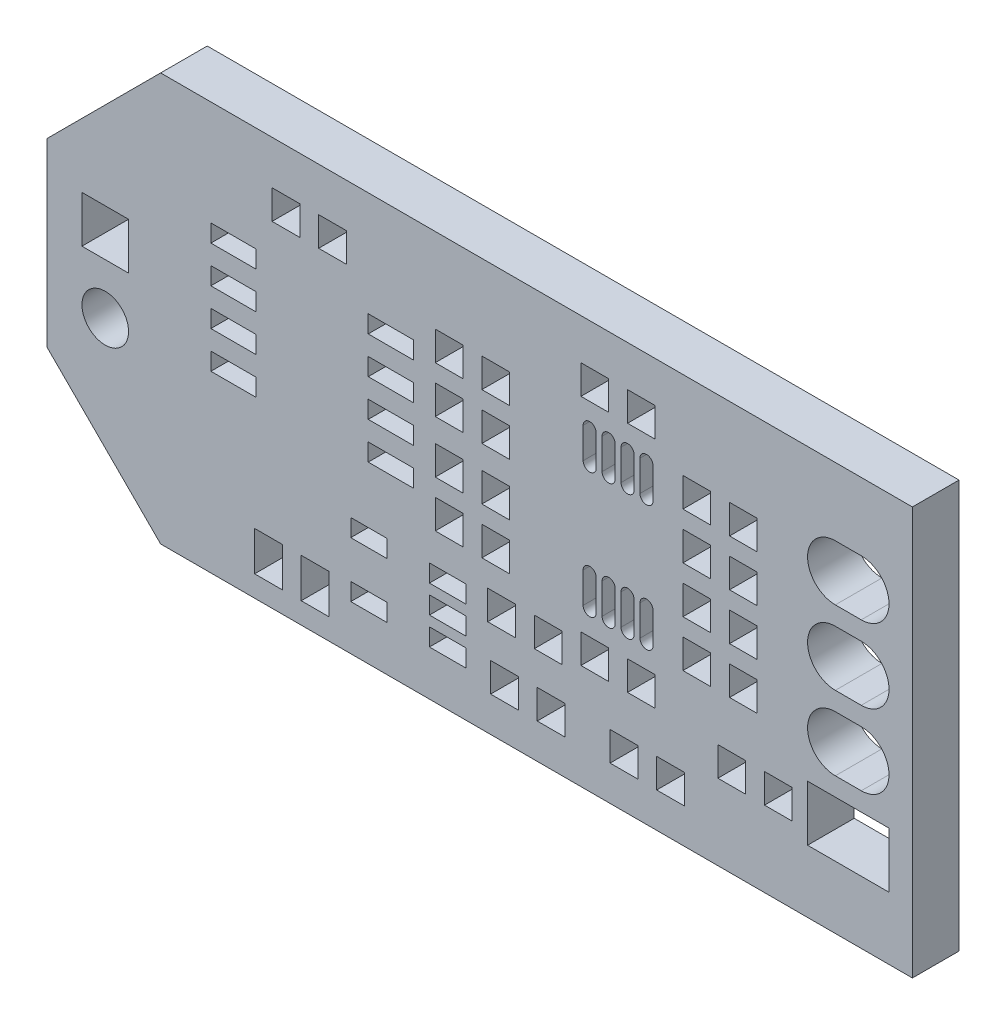
from build123d import *

# Parameters (mm, degrees)
MODEL_R             = 0.8
MODEL_W             = 1.2499
MODEL_H             = 0.5999
MODEL_W_2           = 2.794
MODEL_H_2           = 1.905
MODEL_W_3           = 1.6
MODEL_H_3           = 1.6
MODEL_W_4           = 0.95
MODEL_H_4           = 1.35
MODEL_H_5           = 1
MODEL_W_5           = 1.55
MODEL_H_6           = 0.6
BOSS_EXTRUDE1_DEPTH = 1.6


with BuildPart() as part:
    # Model → Boss-Extrude1 (new body)
    with BuildSketch(Plane.XY):
        Polygon((-146, 24.3), (-120.2, 24.3), (-120.2, 38.3), (-146, 38.3), (-149.9, 34.4), (-149.9, 28.2), align=None)
        with Locations((-147.9, 30.06)):
            Circle(MODEL_R, mode=Mode.SUBTRACT)
        with Locations((-136.15, 26.15)):
            Rectangle(MODEL_W, MODEL_H, mode=Mode.SUBTRACT)
        with Locations((-136.15, 27.1)):
            Rectangle(MODEL_W, MODEL_H, mode=Mode.SUBTRACT)
        with Locations((-136.15, 28.05)):
            Rectangle(MODEL_W, MODEL_H, mode=Mode.SUBTRACT)
        with Locations((-138.85, 28.05)):
            Rectangle(MODEL_W, MODEL_H, mode=Mode.SUBTRACT)
        with Locations((-138.85, 26.15)):
            Rectangle(MODEL_W, MODEL_H, mode=Mode.SUBTRACT)
        with Locations((-122.4, 27.4)):
            Rectangle(MODEL_W_2, MODEL_H_2, mode=Mode.SUBTRACT)
        with BuildLine():
            Line((-122.8445, 30.8925), (-121.9555, 30.8925))
            ThreePointArc((-121.9555, 30.8925), (-121.003, 29.94), (-121.9555, 28.9875))
            Line((-121.9555, 28.9875), (-122.8445, 28.9875))
            ThreePointArc((-122.8445, 28.9875), (-123.797, 29.94), (-122.8445, 30.8925))
        make_face(mode=Mode.SUBTRACT)
        with BuildLine():
            Line((-122.8445, 33.4325), (-121.9555, 33.4325))
            ThreePointArc((-121.9555, 33.4325), (-121.003, 32.48), (-121.9555, 31.5275))
            Line((-121.9555, 31.5275), (-122.8445, 31.5275))
            ThreePointArc((-122.8445, 31.5275), (-123.797, 32.48), (-122.8445, 33.4325))
        make_face(mode=Mode.SUBTRACT)
        with BuildLine():
            Line((-122.8445, 35.9725), (-121.9555, 35.9725))
            ThreePointArc((-121.9555, 35.9725), (-121.003, 35.02), (-121.9555, 34.0675))
            Line((-121.9555, 34.0675), (-122.8445, 34.0675))
            ThreePointArc((-122.8445, 34.0675), (-123.797, 35.02), (-122.8445, 35.9725))
        make_face(mode=Mode.SUBTRACT)
        with Locations((-147.9, 32.6)):
            Rectangle(MODEL_W_3, MODEL_H_3, mode=Mode.SUBTRACT)
        with Locations((-142.3, 25.7)):
            Rectangle(MODEL_W_4, MODEL_H_4, mode=Mode.SUBTRACT)
        with Locations((-140.7, 25.7)):
            Rectangle(MODEL_W_4, MODEL_H_4, mode=Mode.SUBTRACT)
        with BuildLine():
            Line((-131.05, 30.775), (-131.05, 29.725))
            ThreePointArc((-131.05, 29.725), (-131.275, 29.5), (-131.5, 29.725))
            Line((-131.5, 29.725), (-131.5, 30.775))
            ThreePointArc((-131.5, 30.775), (-131.275, 31), (-131.05, 30.775))
        make_face(mode=Mode.SUBTRACT)
        with BuildLine():
            Line((-130.4, 30.775), (-130.4, 29.725))
            ThreePointArc((-130.4, 29.725), (-130.625, 29.5), (-130.85, 29.725))
            Line((-130.85, 29.725), (-130.85, 30.775))
            ThreePointArc((-130.85, 30.775), (-130.625, 31), (-130.4, 30.775))
        make_face(mode=Mode.SUBTRACT)
        with BuildLine():
            Line((-129.75, 30.775), (-129.75, 29.725))
            ThreePointArc((-129.75, 29.725), (-129.975, 29.5), (-130.2, 29.725))
            Line((-130.2, 29.725), (-130.2, 30.775))
            ThreePointArc((-130.2, 30.775), (-129.975, 31), (-129.75, 30.775))
        make_face(mode=Mode.SUBTRACT)
        with BuildLine():
            Line((-129.1, 30.775), (-129.1, 29.725))
            ThreePointArc((-129.1, 29.725), (-129.325, 29.5), (-129.55, 29.725))
            Line((-129.55, 29.725), (-129.55, 30.775))
            ThreePointArc((-129.55, 30.775), (-129.325, 31), (-129.1, 30.775))
        make_face(mode=Mode.SUBTRACT)
        with BuildLine():
            Line((-129.1, 35.075), (-129.1, 34.025))
            ThreePointArc((-129.1, 34.025), (-129.325, 33.8), (-129.55, 34.025))
            Line((-129.55, 34.025), (-129.55, 35.075))
            ThreePointArc((-129.55, 35.075), (-129.325, 35.3), (-129.1, 35.075))
        make_face(mode=Mode.SUBTRACT)
        with BuildLine():
            Line((-129.75, 35.075), (-129.75, 34.025))
            ThreePointArc((-129.75, 34.025), (-129.975, 33.8), (-130.2, 34.025))
            Line((-130.2, 34.025), (-130.2, 35.075))
            ThreePointArc((-130.2, 35.075), (-129.975, 35.3), (-129.75, 35.075))
        make_face(mode=Mode.SUBTRACT)
        with BuildLine():
            Line((-130.4, 35.075), (-130.4, 34.025))
            ThreePointArc((-130.4, 34.025), (-130.625, 33.8), (-130.85, 34.025))
            Line((-130.85, 34.025), (-130.85, 35.075))
            ThreePointArc((-130.85, 35.075), (-130.625, 35.3), (-130.4, 35.075))
        make_face(mode=Mode.SUBTRACT)
        with BuildLine():
            Line((-131.05, 35.075), (-131.05, 34.025))
            ThreePointArc((-131.05, 34.025), (-131.275, 33.8), (-131.5, 34.025))
            Line((-131.5, 34.025), (-131.5, 35.075))
            ThreePointArc((-131.5, 35.075), (-131.275, 35.3), (-131.05, 35.075))
        make_face(mode=Mode.SUBTRACT)
        with Locations((-126.4, 27.4)):
            Rectangle(MODEL_W_4, MODEL_H_5, mode=Mode.SUBTRACT)
        with Locations((-124.8, 27.4)):
            Rectangle(MODEL_W_4, MODEL_H_5, mode=Mode.SUBTRACT)
        with Locations((-134.2, 26)):
            Rectangle(MODEL_W_4, MODEL_H_5, mode=Mode.SUBTRACT)
        with Locations((-132.6, 26)):
            Rectangle(MODEL_W_4, MODEL_H_5, mode=Mode.SUBTRACT)
        with Locations((-134.3, 28.1)):
            Rectangle(MODEL_W_4, MODEL_H_5, mode=Mode.SUBTRACT)
        with Locations((-132.7, 28.1)):
            Rectangle(MODEL_W_4, MODEL_H_5, mode=Mode.SUBTRACT)
        with Locations((-128.5, 26)):
            Rectangle(MODEL_W_4, MODEL_H_5, mode=Mode.SUBTRACT)
        with Locations((-130.1, 26)):
            Rectangle(MODEL_W_4, MODEL_H_5, mode=Mode.SUBTRACT)
        with Locations((-127.6, 30)):
            Rectangle(MODEL_W_4, MODEL_H_5, mode=Mode.SUBTRACT)
        with Locations((-126, 30)):
            Rectangle(MODEL_W_4, MODEL_H_5, mode=Mode.SUBTRACT)
        with Locations((-127.6, 34.8)):
            Rectangle(MODEL_W_4, MODEL_H_5, mode=Mode.SUBTRACT)
        with Locations((-126, 34.8)):
            Rectangle(MODEL_W_4, MODEL_H_5, mode=Mode.SUBTRACT)
        with Locations((-127.6, 31.6)):
            Rectangle(MODEL_W_4, MODEL_H_5, mode=Mode.SUBTRACT)
        with Locations((-126, 31.6)):
            Rectangle(MODEL_W_4, MODEL_H_5, mode=Mode.SUBTRACT)
        with Locations((-127.6, 33.2)):
            Rectangle(MODEL_W_4, MODEL_H_5, mode=Mode.SUBTRACT)
        with Locations((-126, 33.2)):
            Rectangle(MODEL_W_4, MODEL_H_5, mode=Mode.SUBTRACT)
        with Locations((-136.1, 34.9)):
            Rectangle(MODEL_W_4, MODEL_H_5, mode=Mode.SUBTRACT)
        with Locations((-134.5, 34.9)):
            Rectangle(MODEL_W_4, MODEL_H_5, mode=Mode.SUBTRACT)
        with Locations((-136.1, 29.9)):
            Rectangle(MODEL_W_4, MODEL_H_5, mode=Mode.SUBTRACT)
        with Locations((-134.5, 29.9)):
            Rectangle(MODEL_W_4, MODEL_H_5, mode=Mode.SUBTRACT)
        with Locations((-131.1, 36.4)):
            Rectangle(MODEL_W_4, MODEL_H_5, mode=Mode.SUBTRACT)
        with Locations((-129.5, 36.4)):
            Rectangle(MODEL_W_4, MODEL_H_5, mode=Mode.SUBTRACT)
        with Locations((-131.1, 28.4)):
            Rectangle(MODEL_W_4, MODEL_H_5, mode=Mode.SUBTRACT)
        with Locations((-129.5, 28.4)):
            Rectangle(MODEL_W_4, MODEL_H_5, mode=Mode.SUBTRACT)
        with Locations((-134.5, 31.5)):
            Rectangle(MODEL_W_4, MODEL_H_5, mode=Mode.SUBTRACT)
        with Locations((-136.1, 31.5)):
            Rectangle(MODEL_W_4, MODEL_H_5, mode=Mode.SUBTRACT)
        with Locations((-134.5, 33.3)):
            Rectangle(MODEL_W_4, MODEL_H_5, mode=Mode.SUBTRACT)
        with Locations((-136.1, 33.3)):
            Rectangle(MODEL_W_4, MODEL_H_5, mode=Mode.SUBTRACT)
        with Locations((-141.7, 36.3)):
            Rectangle(MODEL_W_4, MODEL_H_5, mode=Mode.SUBTRACT)
        with Locations((-140.1, 36.3)):
            Rectangle(MODEL_W_4, MODEL_H_5, mode=Mode.SUBTRACT)
        with Locations((-143.5, 34.405)):
            Rectangle(MODEL_W_5, MODEL_H_6, mode=Mode.SUBTRACT)
        with Locations((-143.5, 33.135)):
            Rectangle(MODEL_W_5, MODEL_H_6, mode=Mode.SUBTRACT)
        with Locations((-143.5, 31.865)):
            Rectangle(MODEL_W_5, MODEL_H_6, mode=Mode.SUBTRACT)
        with Locations((-143.5, 30.595)):
            Rectangle(MODEL_W_5, MODEL_H_6, mode=Mode.SUBTRACT)
        with Locations((-138.1, 30.595)):
            Rectangle(MODEL_W_5, MODEL_H_6, mode=Mode.SUBTRACT)
        with Locations((-138.1, 31.865)):
            Rectangle(MODEL_W_5, MODEL_H_6, mode=Mode.SUBTRACT)
        with Locations((-138.1, 33.135)):
            Rectangle(MODEL_W_5, MODEL_H_6, mode=Mode.SUBTRACT)
        with Locations((-138.1, 34.405)):
            Rectangle(MODEL_W_5, MODEL_H_6, mode=Mode.SUBTRACT)
    extrude(amount=BOSS_EXTRUDE1_DEPTH)


solid = part.part
